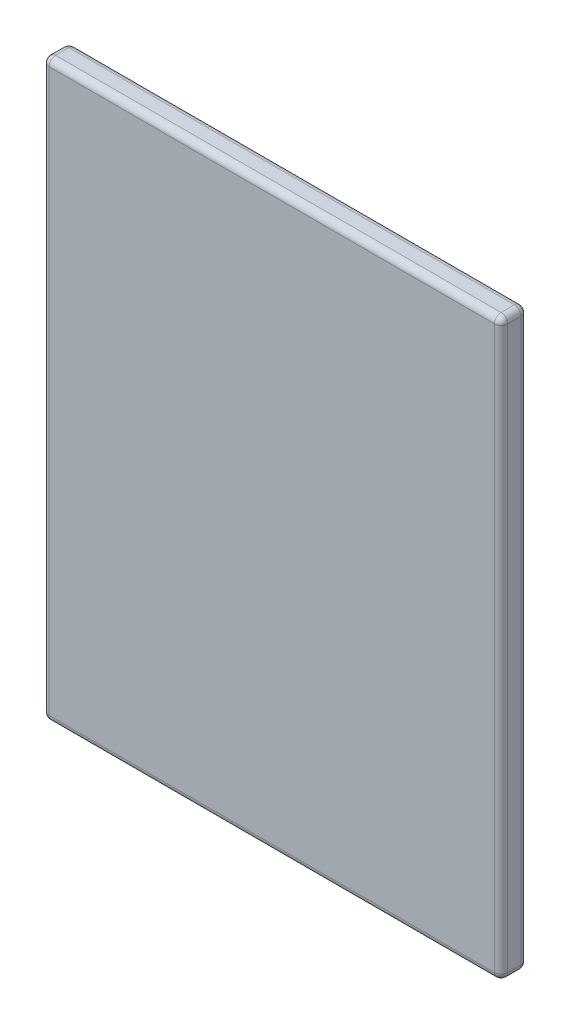
from build123d import *

# Parameters (mm, degrees)
SKETCH1_W           = 34.7
SKETCH1_H           = 43.5
BOSS_EXTRUDE1_DEPTH = 2
FILLET1_R           = 0.5


with BuildPart() as part:
    # Sketch1 → Boss-Extrude1 (new body)
    with BuildSketch(Plane.XY):
        Rectangle(SKETCH1_W, SKETCH1_H)
    extrude(amount=BOSS_EXTRUDE1_DEPTH)

    # Fillet1
    fillet1_edges = [part.edges().sort_by_distance(p)[0] for p in [
        (-17.35, 0, 2),
        (0, -21.75, 2),
        (17.35, 0, 2),
        (0, -21.75, 0),
        (-17.35, 0, 0),
        (0, 21.75, 0),
        (17.35, 0, 0),
        (17.35, -21.75, 1),
        (-17.35, -21.75, 1),
        (-17.35, 21.75, 1),
        (17.35, 21.75, 1),
        (0, 21.75, 2),
    ]]
    fillet(fillet1_edges, radius=FILLET1_R)


solid = part.part
